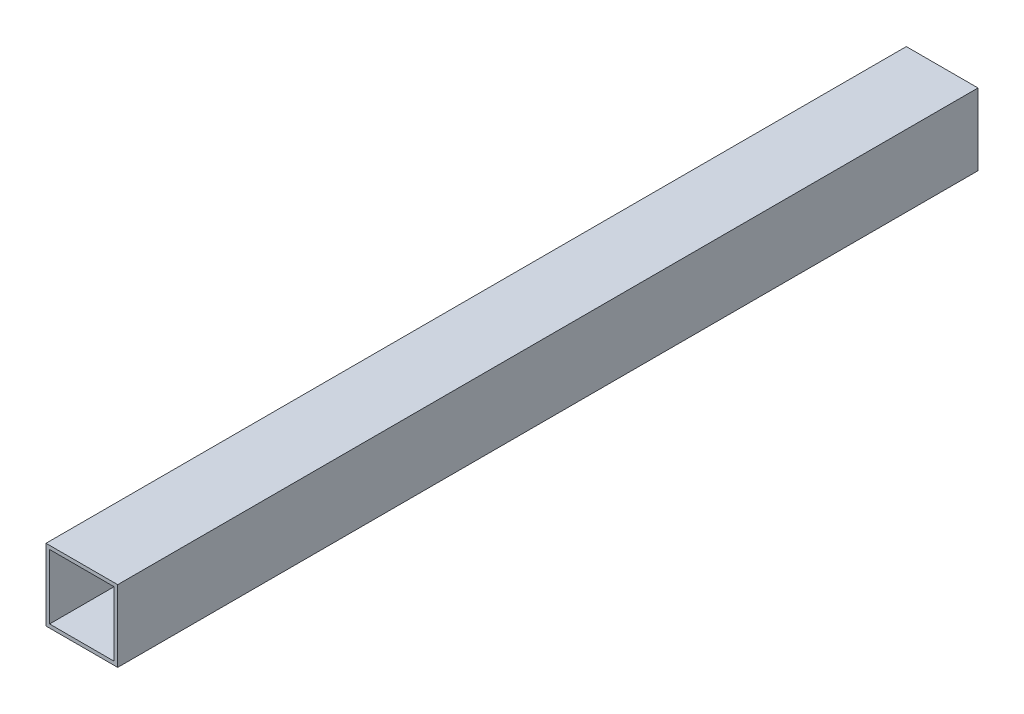
from build123d import *

# Parameters (mm, degrees)
CROQUIS1_W              = 50
CROQUIS1_H              = 50
CROQUIS1_W_2            = 45
CROQUIS1_H_2            = 45
SALIENTE_EXTRUIR1_DEPTH = 300


with BuildPart() as part:
    # Croquis1 → Saliente-Extruir1 (new, symmetric)
    with BuildSketch(Plane.XY):
        Rectangle(CROQUIS1_W, CROQUIS1_H)
        Rectangle(CROQUIS1_W_2, CROQUIS1_H_2, mode=Mode.SUBTRACT)
    extrude(amount=SALIENTE_EXTRUIR1_DEPTH, both=True)


solid = part.part
